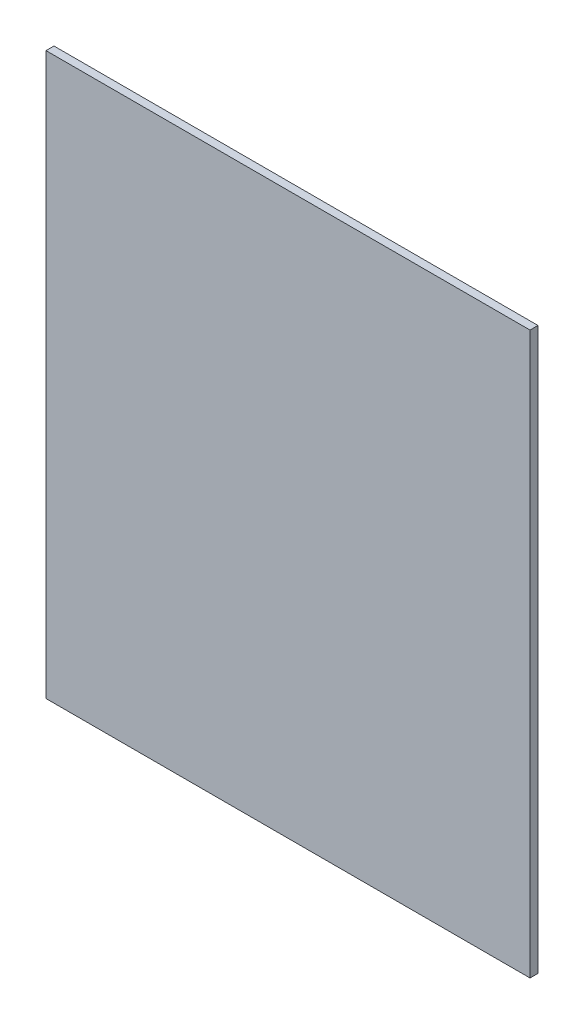
from build123d import *

# Parameters (mm, degrees)
SKETCH_1_W         = 182
SKETCH_1_H         = 211
BLOCKEXTRUDE_DEPTH = 3


with BuildPart() as part:
    # 草图1 → BlockExtrude (new body)
    with BuildSketch(Plane.XY):
        with Locations((91, 105.5)):
            Rectangle(SKETCH_1_W, SKETCH_1_H)
    extrude(amount=BLOCKEXTRUDE_DEPTH)


solid = part.part
